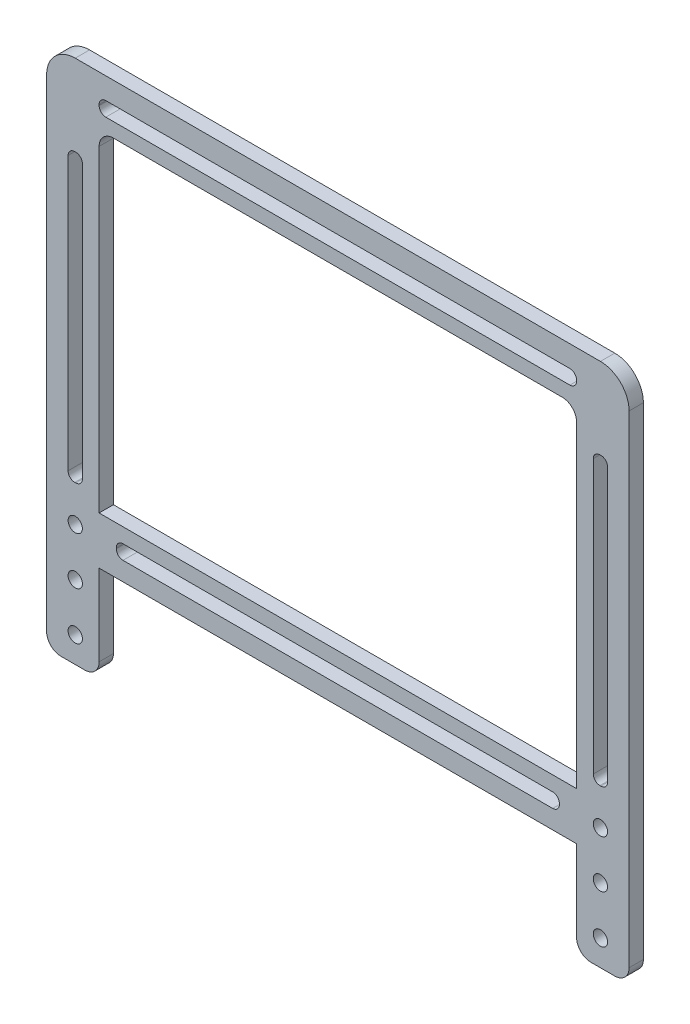
from build123d import *

# Parameters (mm, degrees)
SKETCH1_R           = 1.5
BOSS_EXTRUDE1_DEPTH = 3


with BuildPart() as part:
    # Sketch1 → Boss-Extrude1 (new body)
    with BuildSketch(Plane.XY):
        with BuildLine():
            Line((-61, -52), (-61, 49))
            ThreePointArc((-61, 49), (-59.242640687, 53.242640687), (-55, 55))
            Line((-55, 55), (55, 55))
            ThreePointArc((55, 55), (59.242640687, 53.242640687), (61, 49))
            Line((61, 49), (61, -52))
            ThreePointArc((61, -52), (60.121320344, -54.121320344), (58, -55))
            Line((58, -55), (53, -55))
            ThreePointArc((53, -55), (50.878679656, -54.121320344), (50, -52))
            Line((50, -52), (50, -35))
            Line((50, -35), (-50, -35))
            Line((-50, -35), (-50, -52))
            ThreePointArc((-50, -52), (-50.878679656, -54.121320344), (-53, -55))
            Line((-53, -55), (-58, -55))
            ThreePointArc((-58, -55), (-60.121320344, -54.121320344), (-61, -52))
        make_face()
        with Locations((-55, -49.590163934)):
            Circle(SKETCH1_R, mode=Mode.SUBTRACT)
        with Locations((55, -49.590163934)):
            Circle(SKETCH1_R, mode=Mode.SUBTRACT)
        with Locations((-55, -39.590163934)):
            Circle(SKETCH1_R, mode=Mode.SUBTRACT)
        with Locations((-55, -29.590163934)):
            Circle(SKETCH1_R, mode=Mode.SUBTRACT)
        with Locations((55, -39.590163934)):
            Circle(SKETCH1_R, mode=Mode.SUBTRACT)
        with Locations((55, -29.590163934)):
            Circle(SKETCH1_R, mode=Mode.SUBTRACT)
        with BuildLine():
            Line((-47, 44.5), (47, 44.5))
            ThreePointArc((47, 44.5), (49.121320344, 43.621320344), (50, 41.5))
            Line((50, 41.5), (50, -25))
            Line((50, -25), (-50, -25))
            Line((-50, -25), (-50, 41.5))
            ThreePointArc((-50, 41.5), (-49.121320344, 43.621320344), (-47, 44.5))
        make_face(mode=Mode.SUBTRACT)
        with BuildLine():
            Line((48.6, 50.5), (-48.6, 50.5))
            ThreePointArc((-48.6, 50.5), (-49.589949494, 50.089949494), (-50, 49.1))
            Line((-50, 49.1), (-50, 48.9))
            ThreePointArc((-50, 48.9), (-49.589949494, 47.910050506), (-48.6, 47.5))
            Line((-48.6, 47.5), (48.6, 47.5))
            ThreePointArc((48.6, 47.5), (49.589949494, 47.910050506), (50, 48.9))
            Line((50, 48.9), (50, 49.1))
            ThreePointArc((50, 49.1), (49.589949494, 50.089949494), (48.6, 50.5))
        make_face(mode=Mode.SUBTRACT)
        with BuildLine():
            Line((-55.1, 38.001292496), (-54.9, 38.001292496))
            ThreePointArc((-54.9, 38.001292496), (-53.910050506, 37.59124199), (-53.5, 36.601292496))
            Line((-53.5, 36.601292496), (-53.5, -20.598707504))
            ThreePointArc((-53.5, -20.598707504), (-53.910050506, -21.588656998), (-54.9, -21.998707504))
            Line((-54.9, -21.998707504), (-55.1, -21.998707504))
            ThreePointArc((-55.1, -21.998707504), (-56.089949494, -21.588656998), (-56.5, -20.598707504))
            Line((-56.5, -20.598707504), (-56.5, 36.601292496))
            ThreePointArc((-56.5, 36.601292496), (-56.089949494, 37.59124199), (-55.1, 38.001292496))
        make_face(mode=Mode.SUBTRACT)
        with BuildLine():
            Line((55.1, 38.001292496), (54.9, 38.001292496))
            ThreePointArc((54.9, 38.001292496), (53.910050506, 37.59124199), (53.5, 36.601292496))
            Line((53.5, 36.601292496), (53.5, -20.598707504))
            ThreePointArc((53.5, -20.598707504), (53.910050506, -21.588656998), (54.9, -21.998707504))
            Line((54.9, -21.998707504), (55.1, -21.998707504))
            ThreePointArc((55.1, -21.998707504), (56.089949494, -21.588656998), (56.5, -20.598707504))
            Line((56.5, -20.598707504), (56.5, 36.601292496))
            ThreePointArc((56.5, 36.601292496), (56.089949494, 37.59124199), (55.1, 38.001292496))
        make_face(mode=Mode.SUBTRACT)
        with BuildLine():
            Line((45, -28.090163934), (-45, -28.090163934))
            ThreePointArc((-45, -28.090163934), (-45.989949494, -28.500214441), (-46.4, -29.490163934))
            Line((-46.4, -29.490163934), (-46.4, -29.690163934))
            ThreePointArc((-46.4, -29.690163934), (-45.989949494, -30.680113428), (-45, -31.090163934))
            Line((-45, -31.090163934), (45, -31.090163934))
            ThreePointArc((45, -31.090163934), (45.989949494, -30.680113428), (46.4, -29.690163934))
            Line((46.4, -29.690163934), (46.4, -29.490163934))
            ThreePointArc((46.4, -29.490163934), (45.989949494, -28.500214441), (45, -28.090163934))
        make_face(mode=Mode.SUBTRACT)
    extrude(amount=BOSS_EXTRUDE1_DEPTH)


solid = part.part
